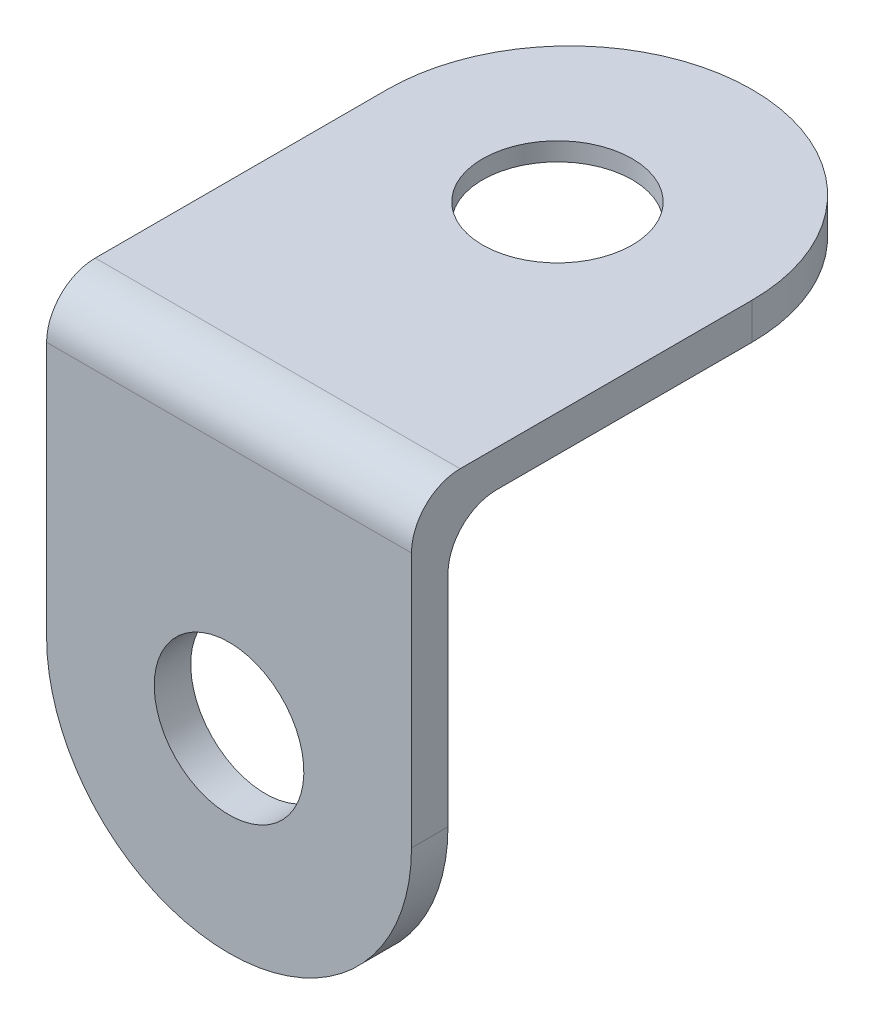
from build123d import *

# Parameters (mm, degrees)
SKETCH1_R           = 3.075
BOSS_EXTRUDE1_DEPTH = 1.5
CIRPATTERN1_COUNT   = 2
CIRPATTERN1_ANGLE   = 90
FILLET1_R           = 2
SKETCH3_R           = 3.075
CUT_EXTRUDE2_DEPTH  = 0.75
CUT_EXTRUDE2_DRAFT  = -60


with BuildPart() as part:
    # Sketch1 → Boss-Extrude1 (new body)
    with BuildSketch(Plane(origin=(0, 0, 0), x_dir=(1, 0, 0), z_dir=(0, 1, 0))):
        with BuildLine():
            Line((-7.5, 0), (7.5, 0))
            Line((7.5, 0), (7.5, 12.5))
            ThreePointArc((7.5, 12.5), (0, 20), (-7.5, 12.5))
            Line((-7.5, 12.5), (-7.5, 0))
        make_face()
        with Locations(Location((0, 12, 0), (0, 0, 270))):
            Circle(SKETCH1_R, mode=Mode.SUBTRACT)
    boss_extrude1 = extrude(amount=BOSS_EXTRUDE1_DEPTH)

    # CirPattern1: Boss-Extrude1 ×2 about axis
    cirpattern1_axis = Axis((-7.5, 1.5, 0), (-1, 0, 0))
    for i in range(1, CIRPATTERN1_COUNT):
        add(boss_extrude1.rotate(cirpattern1_axis, i * CIRPATTERN1_ANGLE / (CIRPATTERN1_COUNT - 1)))

    # Fillet1
    fillet1_edges = [part.edges().sort_by_distance(p)[0] for p in [
        (0, 1.5, 1.5),
        (0, 0, 0),
    ]]
    fillet(fillet1_edges, radius=FILLET1_R)


with BuildPart() as cut_extrude2_tool:
    # Sketch3 → Cut-Extrude2 (with draft: the straight prism first)
    with BuildSketch(Plane(origin=(0, 0.75, 0), x_dir=(-1, 0, 0), z_dir=(0, -1, 0))):
        with Locations(Location((0, 12, 0), (0, 0, 90))):
            Circle(SKETCH3_R)
    extrude(amount=CUT_EXTRUDE2_DEPTH)
    # Cut-Extrude2: the draft: its side faces are tilted about the plane it starts from
    cut_extrude2_sides = [cut_extrude2_tool.faces().sort_by_distance(p)[0] for p in [
        (0, 0.375, -8.925),
    ]]
    draft(cut_extrude2_sides, Plane(origin=(0, 0.75, 0), x_dir=(-1, 0, 0), z_dir=(0, -1, 0)), CUT_EXTRUDE2_DRAFT)


with BuildPart() as part_1:
    add(part.part)

    # Cut-Extrude2: cut by cut_extrude2_tool
    add(cut_extrude2_tool.part, mode=Mode.SUBTRACT)


solid = part_1.part
